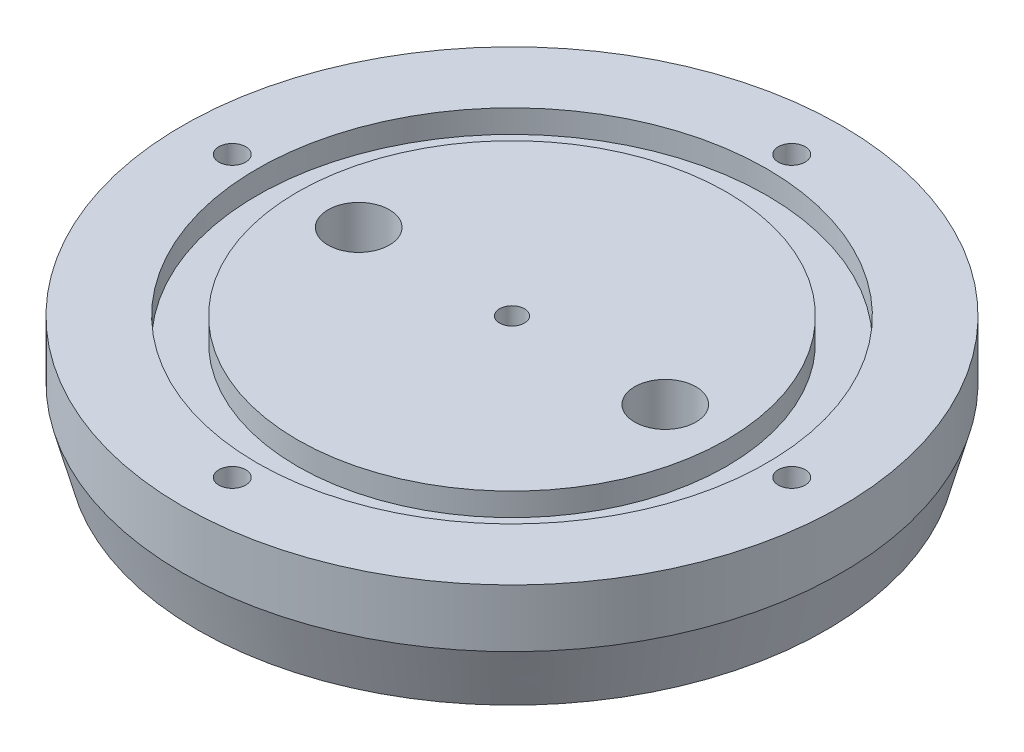
from build123d import *

# Parameters (mm, degrees)
SKETCH1_R           = 43
BOSS_EXTRUDE1_DEPTH = 15
SKETCH2_R           = 4
CUT_EXTRUDE1_DEPTH  = 63.633856659
SKETCH3_R           = 1.625
CUT_EXTRUDE2_DEPTH  = 63.633856659
SKETCH4_R           = 33.25
SKETCH4_R_2         = 28
CUT_EXTRUDE3_DEPTH  = 3
SKETCH5_R           = 1.75
CUT_EXTRUDE4_DEPTH  = 63.633856659
CIRPATTERN1_COUNT   = 4
CHAMFER1_SIZE       = 2
CHAMFER1_SIZE2      = 7.464101615
CHAMFER2_SIZE       = 0.5


with BuildPart() as part:
    # Sketch1 → Boss-Extrude1 (new body)
    with BuildSketch(Plane(origin=(0, 0, 0), x_dir=(1, 0, 0), z_dir=(0, 1, 0))):
        with Locations(Location((0, 0, 0), (0, 0, 270))):
            Circle(SKETCH1_R)
    extrude(amount=BOSS_EXTRUDE1_DEPTH)

    # Sketch2 → Cut-Extrude1 (cut, through all)
    with BuildSketch(Plane.XZ):
        with Locations(Location((20, 0, 0), (0, 0, 270))):
            Circle(SKETCH2_R)
        with Locations(Location((-20, 0, 0), (0, 0, 270))):
            Circle(SKETCH2_R)
    extrude(amount=-CUT_EXTRUDE1_DEPTH, mode=Mode.SUBTRACT)

    # Sketch3 → Cut-Extrude2 (cut, through all)
    with BuildSketch(Plane(origin=(0, 15, 0), x_dir=(1, 0, 0), z_dir=(0, 1, 0))):
        with Locations(Location((0, 0, 0), (0, 0, 270))):
            Circle(SKETCH3_R)
    extrude(amount=-CUT_EXTRUDE2_DEPTH, mode=Mode.SUBTRACT)

    # Sketch4 → Cut-Extrude3 (cut)
    with BuildSketch(Plane(origin=(0, 15, 0), x_dir=(1, 0, 0), z_dir=(0, 1, 0))):
        with Locations(Location((0, 0, 0), (0, 0, 270))):
            Circle(SKETCH4_R)
        with Locations(Location((0, 0, 0), (0, 0, 270))):
            Circle(SKETCH4_R_2, mode=Mode.SUBTRACT)
    extrude(amount=-CUT_EXTRUDE3_DEPTH, mode=Mode.SUBTRACT)

    # Sketch5 → Cut-Extrude4 (cut, through all)
    with BuildSketch(Plane.XZ):
        with Locations(Location((36.5, 0, 0), (0, 0, 270))):
            Circle(SKETCH5_R)
    cut_extrude4 = extrude(amount=-CUT_EXTRUDE4_DEPTH, mode=Mode.SUBTRACT)

    # CirPattern1: Cut-Extrude4 ×4 about axis
    cirpattern1_axis = Axis((0, 0, 0), (0, 1, 0))
    for i in range(1, CIRPATTERN1_COUNT):
        add(cut_extrude4.rotate(cirpattern1_axis, i * 360 / CIRPATTERN1_COUNT), mode=Mode.SUBTRACT)

    # Chamfer1
    chamfer1_edges = [part.edges().sort_by_distance(p)[0] for p in [
        (0, 0, -43),
    ]]
    chamfer1_side = [part.faces().sort_by_distance(p)[0] for p in [
        (0, 0, -41.783776336),
    ]]
    chamfer(chamfer1_edges, length=CHAMFER1_SIZE, length2=CHAMFER1_SIZE2, reference=chamfer1_side[0])

    # Chamfer2
    chamfer2_edges = [part.edges().sort_by_distance(p)[0] for p in [
        (-20, 0, 4),
        (0, 0, -1.625),
        (20, 0, 4),
    ]]
    chamfer(chamfer2_edges, length=CHAMFER2_SIZE)


solid = part.part
